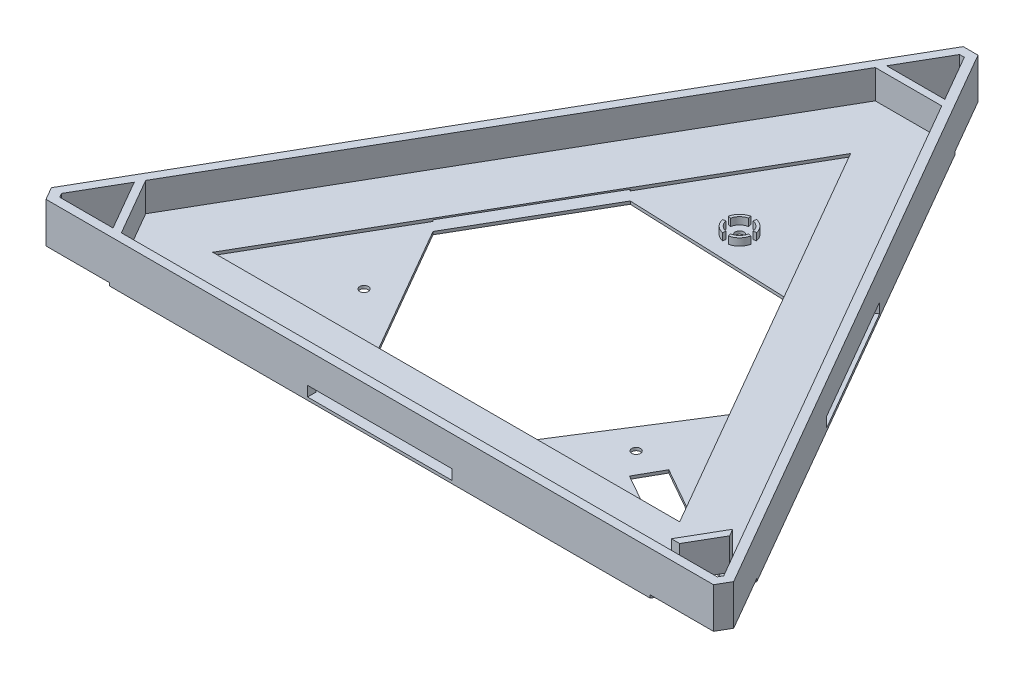
from build123d import *

# Parameters (mm, degrees)
BOSS_EXTRUDE1_DEPTH      = 1
BOSS_EXTRUDE2_DEPTH      = 11
BOSS_EXTRUDE3_DEPTH      = 5
BOSS_EXTRUDE3_DEPTH_BACK = 3
SKETCH3_W                = 50
SKETCH3_H                = 7
CUT_EXTRUDE3_DEPTH       = 25
SKETCH5_W                = 50
SKETCH5_H                = 7
CUT_EXTRUDE4_DEPTH       = 25
SKETCH6_W                = 50
SKETCH6_H                = 7
CUT_EXTRUDE5_DEPTH       = 25
SKETCH8_R                = 1.5
BOSS_EXTRUDE5_DEPTH      = 1
BOSS_EXTRUDE7_DEPTH      = 2.5


with BuildPart() as part:
    # Sketch1 → Boss-Extrude1 (new body)
    with BuildSketch(Plane(origin=(0, 0, 0), x_dir=(1, 0, 0), z_dir=(0, 1, 0))):
        Polygon((243.304219773, -116.484791866), (254.809280576, -136.408896139), (442.602090749, -136.409305398), (444.621046679, -132.925433223), (441.749040748, -132.925433223), (449.516726723, -119.471406457), (450.964695297, -121.978953122), (452.699916621, -118.984688017), (358.778179035, 43.666038066), (335.767496284, 43.666038066), align=None)
        Polygon((428.113670919, -116.417164681), (266.439108268, -116.428009241), (347.273609729, 23.609230825), align=None, mode=Mode.SUBTRACT)
    extrude(amount=BOSS_EXTRUDE1_DEPTH)

    # Sketch1<9> → Boss-Extrude2 (add)
    # profile 1 of 2: a face of its own
    with BuildSketch(Plane(origin=(0, 0, 0), x_dir=(1, 0, 0), z_dir=(0, 1, 0))):
        Polygon((229.159432547, -134.984249184), (231.716666588, -139.412373829), (462.829865412, -139.412373829), (465.38624875, -134.984588004), (349.829542096, 65.165499075), (344.716133219, 65.165499075), align=None)
        Polygon((251.922647988, -136.4093054), (233.446303399, -136.408896139), (232.623553959, -134.984217358), (241.860901688, -118.984688019), align=None, mode=Mode.SUBTRACT)
        Polygon((442.602090749, -136.409305398), (254.809280576, -136.408896139), (243.304219773, -116.484791866), (335.767496284, 43.666038066), (358.778179035, 43.666038066), (461.938967957, -134.984588004), (461.116393748, -136.409305398), align=None, mode=Mode.SUBTRACT)
        Polygon((348.096628302, 62.164013367), (357.334800991, 46.166038067), (337.210874326, 46.166038067), (346.44844193, 62.165948237), align=None, mode=Mode.SUBTRACT)
    # profile 2 of 2: a face of its own
    with BuildSketch(Plane(origin=(0, 0, 0), x_dir=(1, 0, 0), z_dir=(0, 1, 0))):
        Polygon((441.749040748, -132.925433223), (444.621046679, -132.925433223), (450.964695297, -121.978953122), (449.516726723, -119.471406457), align=None)
    extrude(amount=BOSS_EXTRUDE2_DEPTH)

    # Sketch1<10> → Boss-Extrude3 (add, two sides: drawn at the far end of the back side and taken through both)
    with BuildSketch(Plane(origin=(0, 0, 0), x_dir=(1, 0, 0), z_dir=(0, 1, 0)).offset(-BOSS_EXTRUDE3_DEPTH_BACK)):
        Polygon((229.159432547, -134.984249184), (231.716666588, -139.412373829), (462.829865412, -139.412373829), (465.38624875, -134.984588004), (349.829542096, 65.165499075), (344.716133219, 65.165499075), align=None)
        Polygon((251.922647988, -136.4093054), (233.446303399, -136.408896139), (232.623553959, -134.984217358), (241.860901688, -118.984688019), align=None, mode=Mode.SUBTRACT)
        Polygon((442.602090749, -136.409305398), (254.809280576, -136.408896139), (243.304219773, -116.484791866), (335.767496284, 43.666038066), (358.778179035, 43.666038066), (452.699916621, -118.984688017), (461.938967957, -134.984588004), (461.116393748, -136.409305398), align=None, mode=Mode.SUBTRACT)
        Polygon((348.096628302, 62.164013367), (357.334800991, 46.166038067), (337.210874326, 46.166038067), (346.44844193, 62.165948237), align=None, mode=Mode.SUBTRACT)
    extrude(amount=BOSS_EXTRUDE3_DEPTH + BOSS_EXTRUDE3_DEPTH_BACK)

    # Sketch3 → Cut-Extrude3 (cut)
    with BuildSketch(Plane(origin=(290.589645397, 0, -167.772009994), x_dir=(-0.49999999999998745, 0, -0.8660254037844459), z_dir=(0.8660254037844459, 0, -0.49999999999998745))):
        with Locations((-236.592990632, -3)):
            Rectangle(SKETCH3_W, SKETCH3_H)
    extrude(amount=-CUT_EXTRUDE3_DEPTH, mode=Mode.SUBTRACT)

    # Sketch5 → Cut-Extrude4 (cut)
    with BuildSketch(Plane.XY.offset(139.412373829)):
        with Locations((347.273266, -3)):
            Rectangle(SKETCH5_W, SKETCH5_H)
    extrude(amount=-CUT_EXTRUDE4_DEPTH, mode=Mode.SUBTRACT)

    # Sketch6 → Cut-Extrude5 (cut)
    with BuildSketch(Plane(origin=(230.319375797, 0, 132.975171838), x_dir=(-0.5000006154012504, 0, 0.8660250484820695), z_dir=(-0.8660250484820695, 0, -0.5000006154012504))):
        with Locations((-113.2366748, -3)):
            Rectangle(SKETCH6_W, SKETCH6_H)
    extrude(amount=-CUT_EXTRUDE5_DEPTH, mode=Mode.SUBTRACT)

    # Sketch8 → Boss-Extrude5 (add)
    with BuildSketch(Plane.XZ.offset(3)):
        Polygon((246.891774838, 127.696996709), (240.128710529, 115.984933576), (333.74677129, -46.166038067), (360.798886024, -46.166038067), (454.427535986, 116.00354071), (450.14703547, 123.280701064), (406.618322212, 98.678849058), (401.697951811, 107.384591709), (445.226665069, 131.986443715), (440.912417704, 139.412373829), (253.656752788, 139.412373829), align=None)
        with Locations((395.323540807, 98.692824234)):
            Circle(SKETCH8_R, mode=Mode.SUBTRACT)
        with Locations((348.301285092, 15.863526629)):
            Circle(SKETCH8_R, mode=Mode.SUBTRACT)
        with Locations((299.654911442, 97.241681781)):
            Circle(SKETCH8_R, mode=Mode.SUBTRACT)
        Polygon((322.273266, 116.424264082), (294.358218631, 68.061097964), (319.354499366, 24.757680453), (376.473657317, 26.969372805), (401.47267951, 70.271207531), (372.273266, 116.420910258), align=None, mode=Mode.SUBTRACT)
    extrude(amount=BOSS_EXTRUDE5_DEPTH)

    # Sketch12 → Boss-Extrude7 (add)
    with BuildSketch(Plane(origin=(0, -3, 0), x_dir=(1, 0, 0), z_dir=(0, 1, 0))):
        with BuildLine():
            ThreePointArc((353.201285092, -14.868539192), (351.836818997, -12.327992723), (349.296272529, -10.963526629))
            Line((349.296272529, -10.963526629), (349.097275041, -11.943526629))
            ThreePointArc((349.097275041, -11.943526629), (351.129712216, -13.035099504), (352.221285092, -15.067536679))
            Line((352.221285092, -15.067536679), (353.201285092, -14.868539192))
        make_face()
        with BuildLine():
            Line((347.505295142, -11.943526629), (347.306297654, -10.963526629))
            ThreePointArc((347.306297654, -10.963526629), (344.765751186, -12.327992723), (343.401285092, -14.868539192))
            Line((343.401285092, -14.868539192), (344.381285092, -15.067536679))
            ThreePointArc((344.381285092, -15.067536679), (345.472857967, -13.035099504), (347.505295142, -11.943526629))
        make_face()
        with BuildLine():
            ThreePointArc((349.296272529, -20.763526629), (351.836818997, -19.399060535), (353.201285092, -16.858514066))
            Line((353.201285092, -16.858514066), (352.221285092, -16.659516578))
            ThreePointArc((352.221285092, -16.659516578), (351.129712216, -18.691953754), (349.097275041, -19.783526629))
            Line((349.097275041, -19.783526629), (349.296272529, -20.763526629))
        make_face()
        with BuildLine():
            Line((344.381285092, -16.659516578), (343.401285092, -16.858514066))
            ThreePointArc((343.401285092, -16.858514066), (344.765751186, -19.399060535), (347.306297654, -20.763526629))
            Line((347.306297654, -20.763526629), (347.505295142, -19.783526629))
            ThreePointArc((347.505295142, -19.783526629), (345.472857967, -18.691953754), (344.381285092, -16.659516578))
        make_face()
    extrude(amount=BOSS_EXTRUDE7_DEPTH)


solid = part.part
